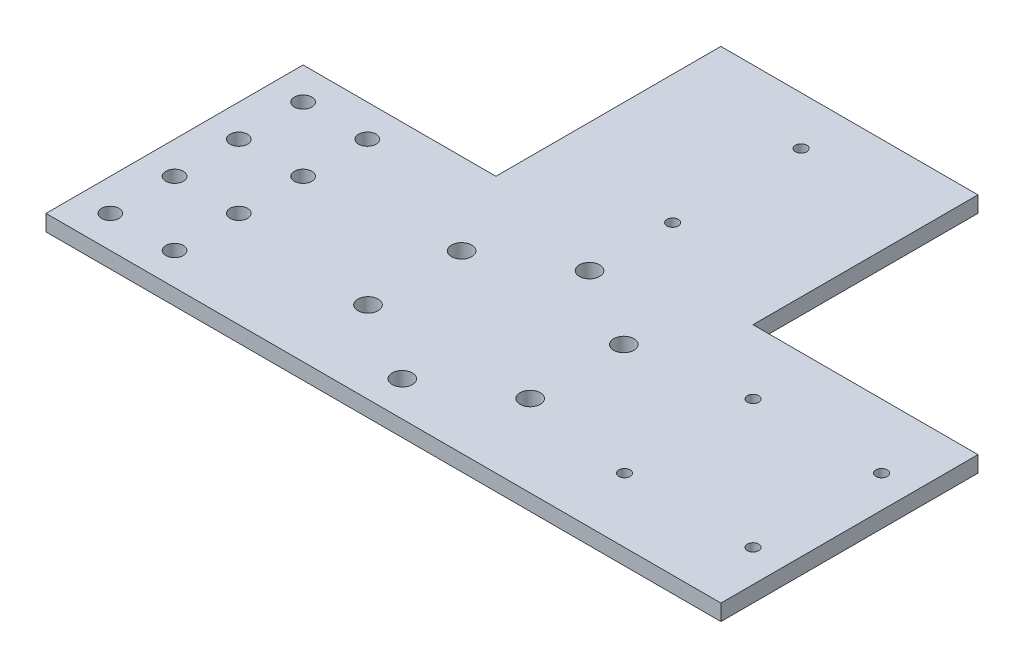
from build123d import *

# Parameters (mm, degrees)
SKETCH1_W                 = 38.1
SKETCH1_H                 = 50.8
SKETCH1_W_2               = 50.8
SKETCH1_H_2               = 44.45
SKETCH1_W_3               = 6.365635467
BOSS_EXTRUDE1_DEPTH       = 3.175
TAP_DRILL_FOR_8_32_TAP1_D = 3.4544
F_4_0_4_DIAMETER_HOLE1_D  = 4
TAP_DRILL_FOR_4_40_TAP1_D = 2.2606
TAP_DRILL_FOR_4_40_TAP2_D = 2.2606


with BuildPart() as part:
    # Sketch1 → Boss-Extrude1 (new body)
    with BuildSketch(Plane(origin=(0, 0, 0), x_dir=(1, 0, 0), z_dir=(0, 1, 0))):
        with Locations((-12.7, -6.35)):
            Rectangle(SKETCH1_W, SKETCH1_H)
        with Locations((31.75, -6.35)):
            Rectangle(SKETCH1_W_2, SKETCH1_H)
        with Locations((31.75, 41.275)):
            Rectangle(SKETCH1_W_2, SKETCH1_H_2)
        with Locations((76.2, -6.35)):
            Rectangle(SKETCH1_W, SKETCH1_H)
        with Locations((98.432817734, -6.35)):
            Rectangle(SKETCH1_W_3, SKETCH1_H)
    extrude(amount=BOSS_EXTRUDE1_DEPTH)

    # Tap Drill for #8-32 Tap1 (through all)
    with Locations(Plane(origin=(-12.7, 3.175, 0), x_dir=(0, 0, 1), z_dir=(0, 1, 0))):
        with Locations((0, 0), (0, -12.7), (12.7, -12.7), (25.4, -12.7), (25.4, 0), (-12.7, 0), (-12.7, -12.7), (12.7, 0)):
            Hole(TAP_DRILL_FOR_8_32_TAP1_D / 2)

    # Ø4.0 (4) Diameter Hole1 (through all)
    with Locations(Plane(origin=(31.75, 3.175, -12.15), x_dir=(0, 0, 1), z_dir=(0, 1, 0))):
        with Locations((0, 0), (9.25, 16.02146997), (27.75, 16.02146997), (37, 0), (27.75, -16.02146997), (9.25, -16.02146997)):
            Hole(F_4_0_4_DIAMETER_HOLE1_D / 2)

    # Tap Drill for #4-40 Tap1 (through all)
    with Locations(Plane(origin=(69.865635467, 3.175, -6.35), x_dir=(0, 0, 1), z_dir=(0, 1, 0))):
        with Locations((0, 0), (0, 25.4), (25.4, 25.4), (25.4, 0)):
            Hole(TAP_DRILL_FOR_4_40_TAP1_D / 2)

    # Tap Drill for #4-40 Tap2 (through all)
    with Locations(Plane(origin=(31.75, 3.175, -53.975), x_dir=(0, 0, 1), z_dir=(0, 1, 0))):
        with Locations((0, 0), (25.4, 0)):
            Hole(TAP_DRILL_FOR_4_40_TAP2_D / 2)


solid = part.part
